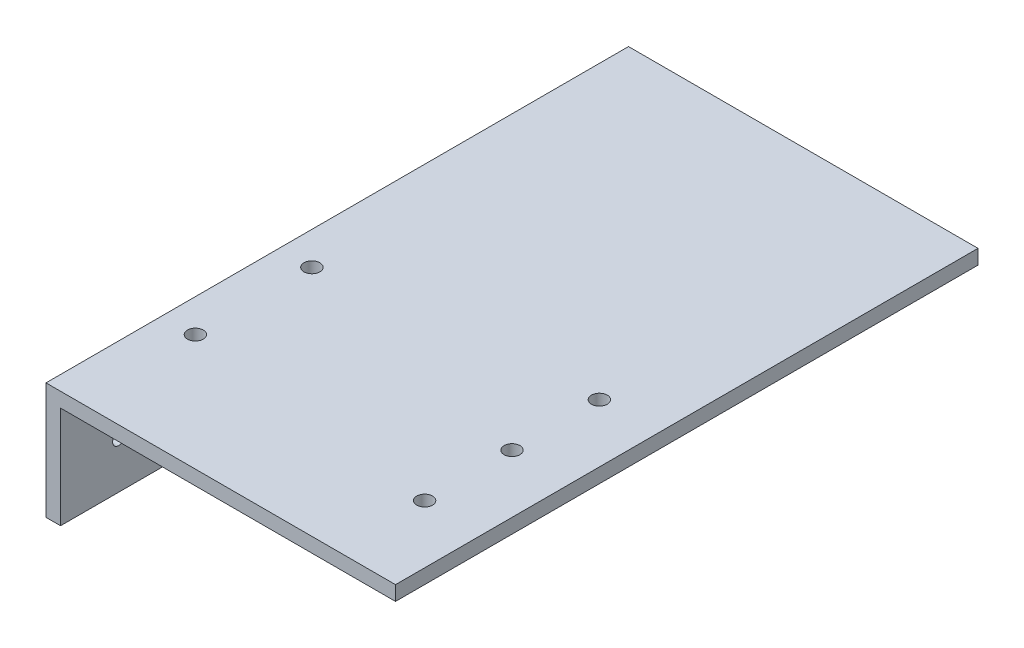
from build123d import *

# Parameters (mm, degrees)
BOSS_EXTRUDE1_DEPTH       = 76.2
CUT_EXTRUDE1_REACH        = 112.716
SKETCH7_R                 = 3.175
TAP_DRILL_FOR_8_32_TAP2_D = 3.4544
TAP_DRILL_FOR_8_32_TAP4_D = 3.4544
TAP_DRILL_FOR_6_32_TAP1_D = 2.7051
BOSS_EXTRUDE2_DEPTH       = 50.8


with BuildPart() as part:
    # Sketch2 → Boss-Extrude1 (new body)
    with BuildSketch(Plane.XY):
        Polygon((0, 0), (-76.2, 0), (-76.2, -25.4), (-73.025, -25.4), (-73.025, -3.175), (0, -3.175), align=None)
    extrude(amount=BOSS_EXTRUDE1_DEPTH)

    # Sketch7 → Cut-Extrude1 (cut, up to next)
    with BuildSketch(Plane.ZY.offset(76.2), mode=Mode.PRIVATE) as cut_extrude1_sk1:
        with Locations((38.1, -15.24)):
            Circle(SKETCH7_R)
    cut_extrude1_tool1 = extrude(cut_extrude1_sk1.sketch, amount=-CUT_EXTRUDE1_REACH, mode=Mode.PRIVATE) & part.part
    add(cut_extrude1_tool1.solids().sort_by_distance((-76.2, -15.24, 38.1))[0], mode=Mode.SUBTRACT)

    # Tap Drill for #8-32 Tap2 (through all)
    with Locations(Plane(origin=(0, 0, 0), x_dir=(1, 0, 0), z_dir=(0, 1, 0))):
        with Locations((-12.7, -19.05), (-12.7, -38.1), (-12.7, -57.15)):
            Hole(TAP_DRILL_FOR_8_32_TAP2_D / 2)

    # Tap Drill for #8-32 Tap4 (through all)
    with Locations(Plane(origin=(0, 0, 0), x_dir=(1, 0, 0), z_dir=(0, 1, 0))):
        with Locations((-69.028514561, -25.4), (-69.028514561, -50.8)):
            Hole(TAP_DRILL_FOR_8_32_TAP4_D / 2)

    # Tap Drill for #6-32 Tap1 (through all)
    with Locations(Plane.ZY.offset(76.2)):
        with Locations((50.8, -15.24), (63.5, -15.24)):
            Hole(TAP_DRILL_FOR_6_32_TAP1_D / 2)

    # Sketch19 → Boss-Extrude2 (add)
    with BuildSketch(Plane(origin=(0, 0, 0), x_dir=(-1, 0, 0), z_dir=(0, 0, -1))):
        Polygon((0, -3.175), (73.025, -3.175), (73.025, -25.4), (76.2, -25.4), (76.2, 0), (0, 0), align=None)
    extrude(amount=BOSS_EXTRUDE2_DEPTH)


solid = part.part
